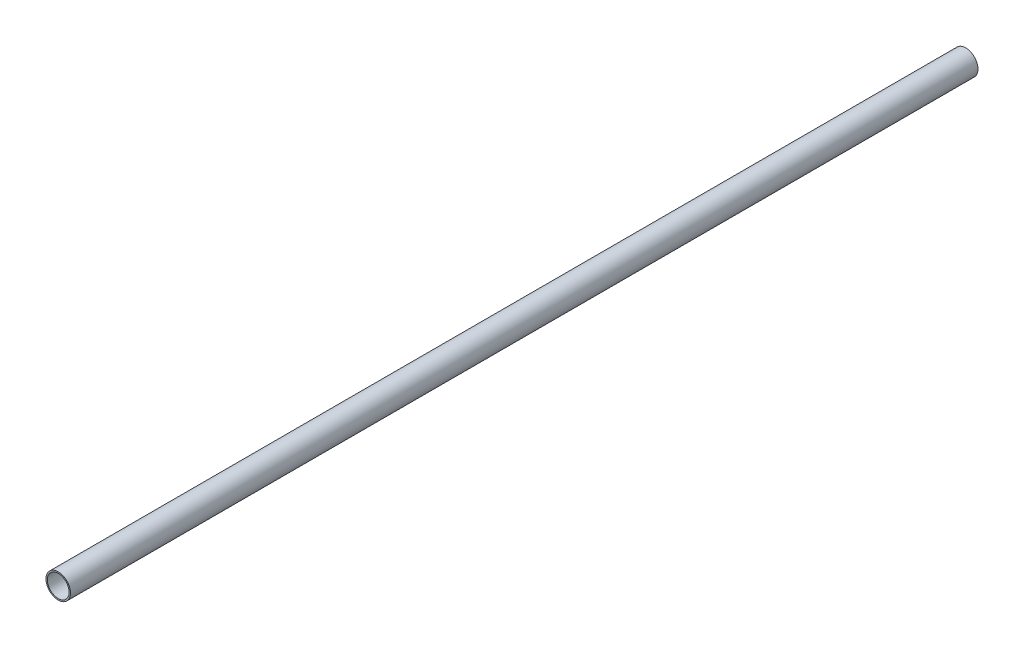
from build123d import *

# Parameters (mm, degrees)
SKETCH1_R           = 13.5
SKETCH1_R_2         = 12
BOSS_EXTRUDE1_DEPTH = 1000


with BuildPart() as part:
    # Sketch1 → Boss-Extrude1 (new body)
    with BuildSketch(Plane.XY):
        Circle(SKETCH1_R)
        Circle(SKETCH1_R_2, mode=Mode.SUBTRACT)
    extrude(amount=BOSS_EXTRUDE1_DEPTH)


solid = part.part
